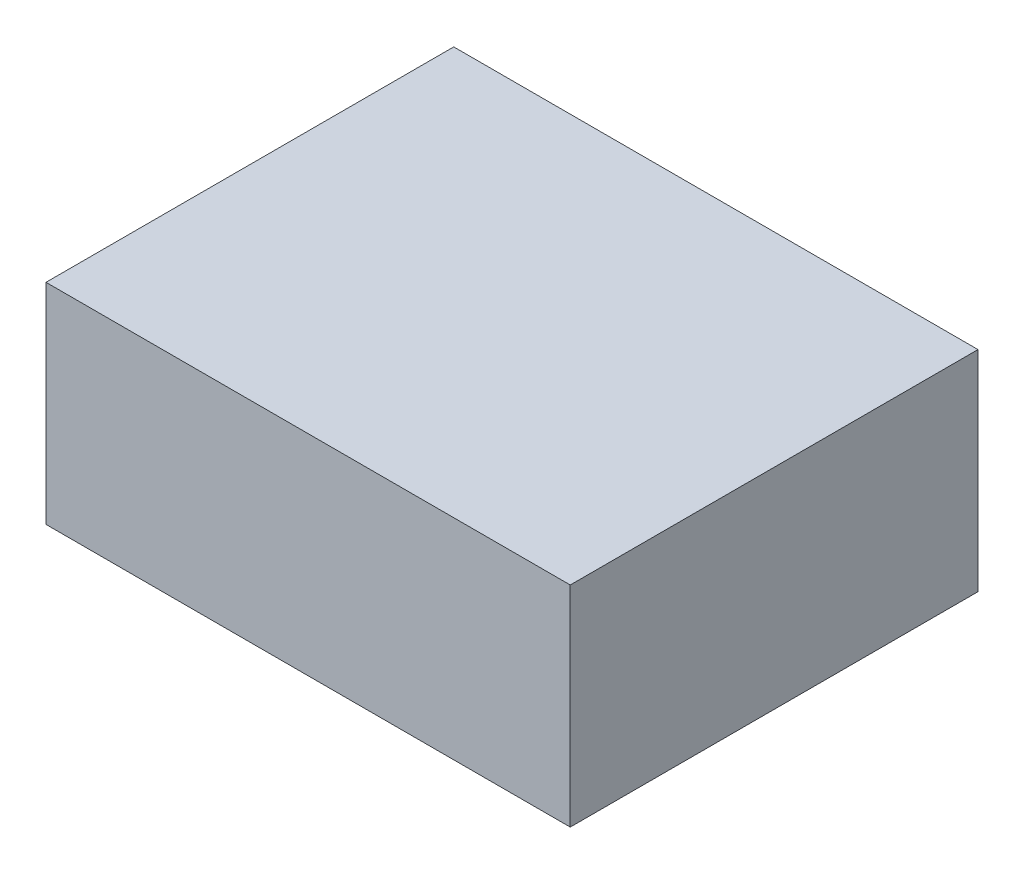
from build123d import *

# Parameters (mm, degrees)
SKETCH1_W           = 45
SKETCH1_H           = 35
BOSS_EXTRUDE1_DEPTH = 18


with BuildPart() as part:
    # Sketch1 → Boss-Extrude1 (new body)
    with BuildSketch(Plane(origin=(0, 0, 0), x_dir=(1, 0, 0), z_dir=(0, 1, 0))):
        Rectangle(SKETCH1_W, SKETCH1_H)
    extrude(amount=BOSS_EXTRUDE1_DEPTH)


solid = part.part
